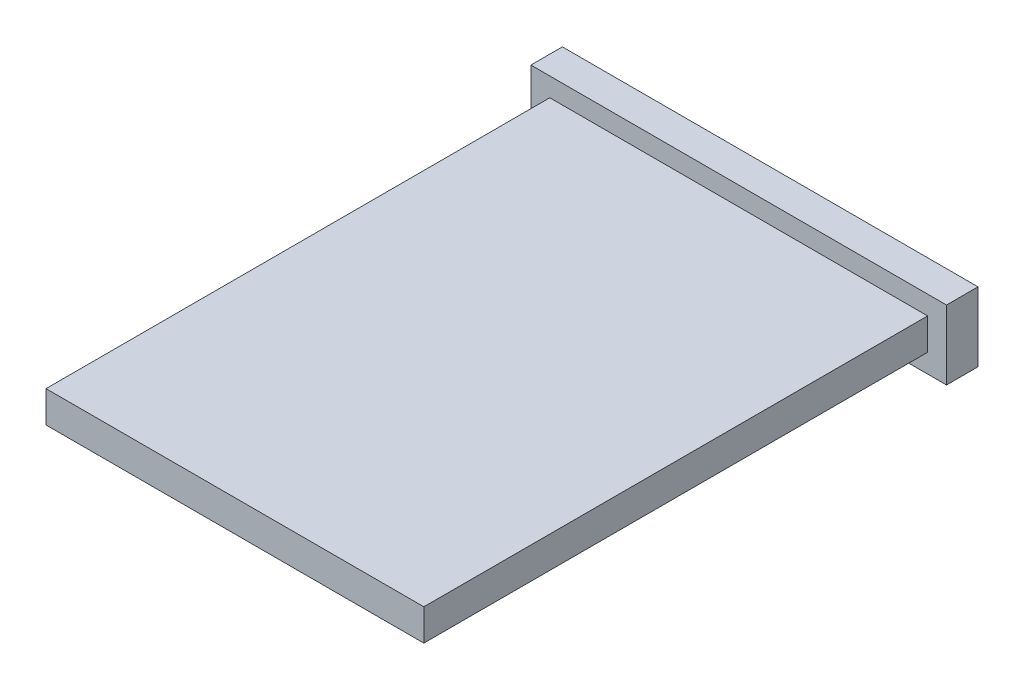
from build123d import *

# Parameters (mm, degrees)
SKETCH1_W           = 60
SKETCH1_H           = 80
BOSS_EXTRUDE1_DEPTH = 5
SKETCH3_W           = 66
SKETCH3_H           = 11
BOSS_EXTRUDE2_DEPTH = 5


with BuildPart() as part:
    # Sketch1 → Boss-Extrude1 (new body)
    with BuildSketch(Plane(origin=(0, 0, 0), x_dir=(1, 0, 0), z_dir=(0, 1, 0))):
        with Locations((30, 40)):
            Rectangle(SKETCH1_W, SKETCH1_H)
    extrude(amount=BOSS_EXTRUDE1_DEPTH)

    # Sketch3 → Boss-Extrude2 (add)
    with BuildSketch(Plane(origin=(0, 0, -80), x_dir=(-1, 0, 0), z_dir=(0, 0, -1))):
        with Locations((-30, 2.5)):
            Rectangle(SKETCH3_W, SKETCH3_H)
    extrude(amount=BOSS_EXTRUDE2_DEPTH)


solid = part.part
